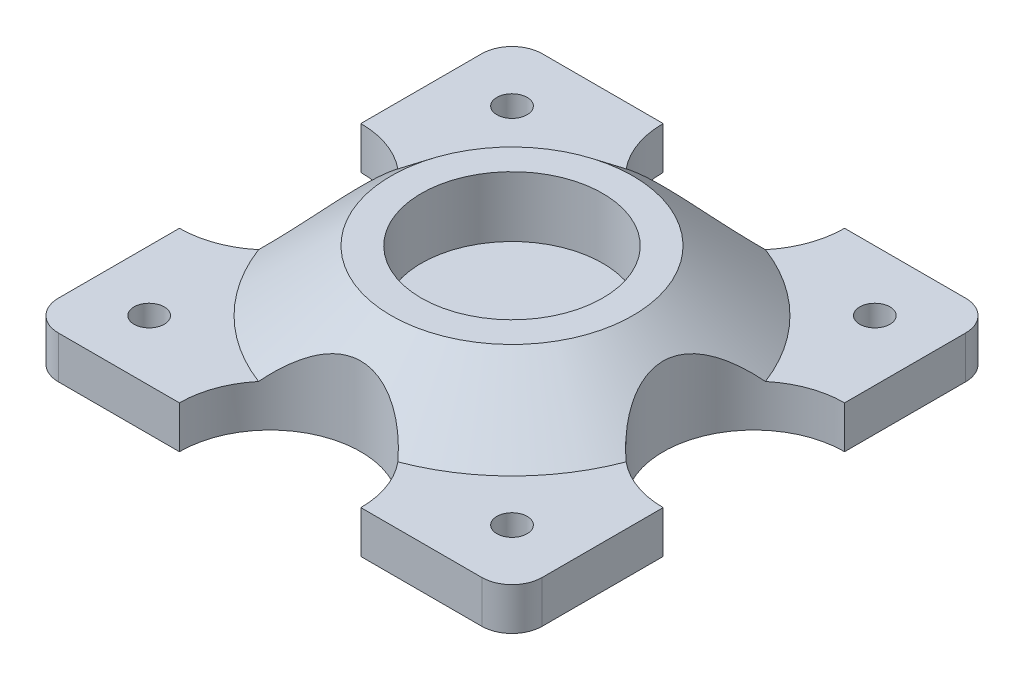
from build123d import *

# Parameters (mm, degrees)
BOSS_EXTRUDE1_DEPTH = 8.89
SKETCH3_R           = 19.05
SKETCH3_R_2         = 3.175
CUT_EXTRUDE1_DEPTH  = 76.016052282
SKETCH3_3_R         = 19.05
CUT_EXTRUDE2_DEPTH  = 12.7


with BuildPart() as part:
    # Sketch1 → Boss-Extrude1 (new body)
    with BuildSketch(Plane(origin=(0, 0, 0), x_dir=(1, 0, 0), z_dir=(0, 1, 0))):
        with BuildLine():
            Line((-44.45, -50.8), (44.45, -50.8))
            ThreePointArc((44.45, -50.8), (48.940128061, -48.940128061), (50.8, -44.45))
            Line((50.8, -44.45), (50.8, 44.45))
            ThreePointArc((50.8, 44.45), (48.940128061, 48.940128061), (44.45, 50.8))
            Line((44.45, 50.8), (-44.45, 50.8))
            ThreePointArc((-44.45, 50.8), (-48.940128061, 48.940128061), (-50.8, 44.45))
            Line((-50.8, 44.45), (-50.8, -44.45))
            ThreePointArc((-50.8, -44.45), (-48.940128061, -48.940128061), (-44.45, -50.8))
        make_face()
    extrude(amount=BOSS_EXTRUDE1_DEPTH)

    # Sketch2 → Revolve1 (revolve)
    with BuildSketch(Plane.XY, mode=Mode.PRIVATE) as revolve1_sk:
        Polygon((0, 21.59), (0, 8.89), (41.275, 8.89), (25.4, 21.59), align=None)
    revolve(revolve1_sk.sketch.rotate(Axis((0, -26.658191996, 0), (0, 1, 0)), 90), axis=Axis((0, -26.658191996, 0), (0, 1, 0)))

    # Sketch3 → Cut-Extrude1 (cut, through all)
    with BuildSketch(Plane(origin=(0, 21.59, 0), x_dir=(1, 0, 0), z_dir=(0, 1, 0))):
        with Locations((-50.8, 0)):
            Circle(SKETCH3_R)
        with Locations((0, 50.8)):
            Circle(SKETCH3_R)
        with Locations((0, -50.8)):
            Circle(SKETCH3_R)
        with Locations((50.8, 0)):
            Circle(SKETCH3_R)
        with Locations(Location((38.1, -38.1, 0), (0, 0, 270))):
            Circle(SKETCH3_R_2)
        with Locations(Location((38.1, 38.1, 0), (0, 0, 270))):
            Circle(SKETCH3_R_2)
        with Locations(Location((-38.1, 38.1, 0), (0, 0, 270))):
            Circle(SKETCH3_R_2)
        with Locations(Location((-38.1, -38.1, 0), (0, 0, 270))):
            Circle(SKETCH3_R_2)
    extrude(amount=-CUT_EXTRUDE1_DEPTH, mode=Mode.SUBTRACT)

    # Sketch3<3> → Cut-Extrude2 (cut)
    with BuildSketch(Plane(origin=(0, 21.59, 0), x_dir=(1, 0, 0), z_dir=(0, 1, 0))):
        with Locations(Location((0, 0, 0), (0, 0, 270))):
            Circle(SKETCH3_3_R)
    extrude(amount=-CUT_EXTRUDE2_DEPTH, mode=Mode.SUBTRACT)


solid = part.part
